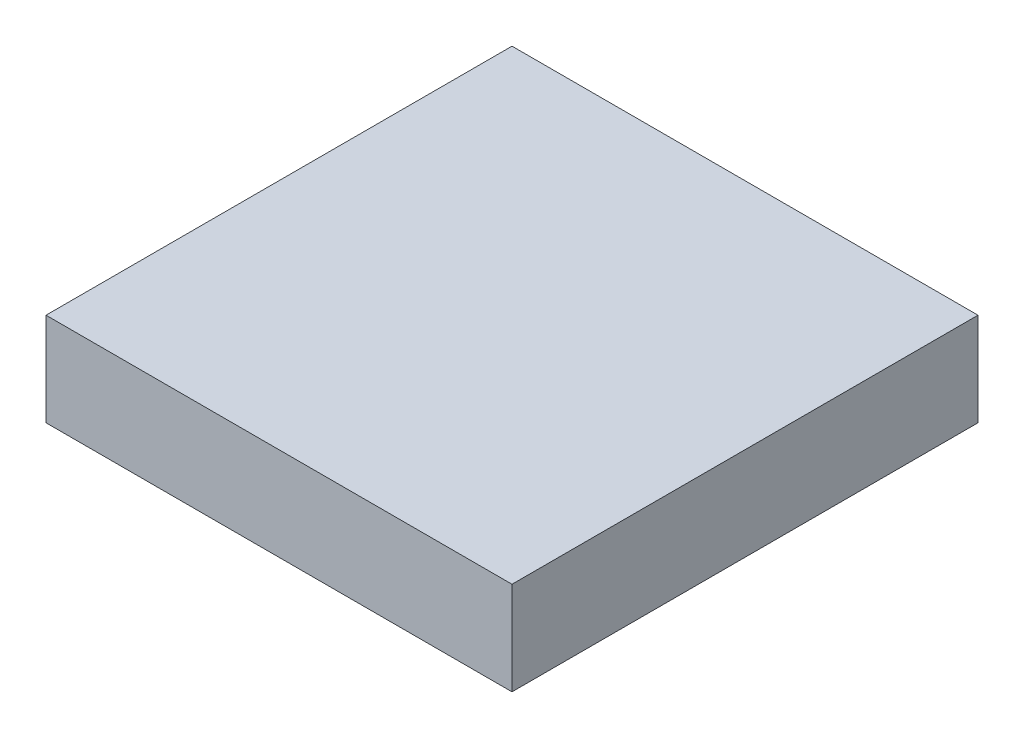
from build123d import *

# Parameters (mm, degrees)
SKETCH1_W           = 16
SKETCH1_H           = 16
BOSS_EXTRUDE1_DEPTH = 3.2
SHELL1_T            = -1.6


with BuildPart() as part:
    # Sketch1 → Boss-Extrude1 (new body)
    with BuildSketch(Plane(origin=(0, 0, 0), x_dir=(1, 0, 0), z_dir=(0, 1, 0))):
        with Locations((8, 8)):
            Rectangle(SKETCH1_W, SKETCH1_H)
    extrude(amount=BOSS_EXTRUDE1_DEPTH)

    # Shell1
    shell1_openings = [part.faces().sort_by_distance(p)[0] for p in [
        (8, 0, -8),
    ]]
    offset(amount=SHELL1_T, openings=shell1_openings, kind=Kind.INTERSECTION)


solid = part.part
